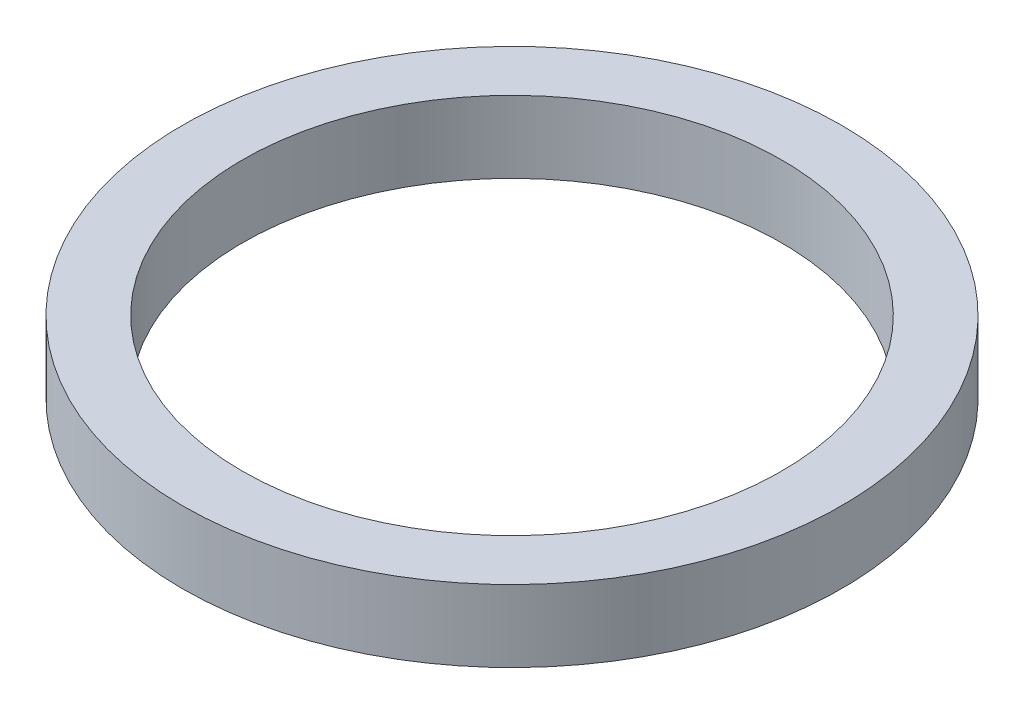
from build123d import *

# Parameters (mm, degrees)
SKETCH_1_R      = 27.5
SKETCH_1_R_2    = 22.5
EXTRUDE_1_DEPTH = 3


with BuildPart() as part:
    # 草圖1 → 填料-伸長1 (new, symmetric)
    with BuildSketch(Plane(origin=(0, 0, 0), x_dir=(1, 0, 0), z_dir=(0, 1, 0))):
        with Locations(Location((0, 0, 0), (0, 0, 270))):
            Circle(SKETCH_1_R)
        with Locations(Location((0, 0, 0), (0, 0, 270))):
            Circle(SKETCH_1_R_2, mode=Mode.SUBTRACT)
    extrude(amount=EXTRUDE_1_DEPTH, both=True)


solid = part.part
